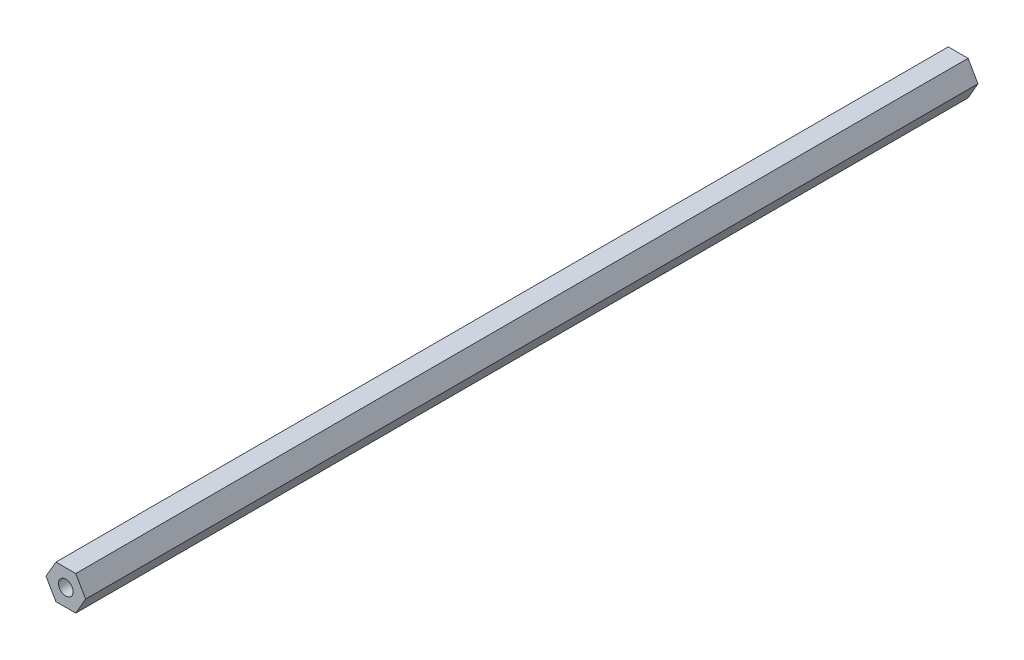
from build123d import *

# Parameters (mm, degrees)
BOSS_EXTRUDE1_DEPTH                   = 165.1
F_1_4_28_TAPPED_HOLE1_D               = 5.4102
F_1_4_28_TAPPED_HOLE1_DEPTH           = 28.194
F_1_4_28_TAPPED_HOLE1_TIP             = 1.625388061
F_1_4_28_TAPPED_HOLE1_ON_FACE_2_D     = 5.4102
F_1_4_28_TAPPED_HOLE1_ON_FACE_2_DEPTH = 28.194
F_1_4_28_TAPPED_HOLE1_ON_FACE_2_TIP   = 1.625388061


with BuildPart() as part:
    # Sketch1 → Boss-Extrude1 (new, symmetric)
    with BuildSketch(Plane.XY):
        Polygon((7.332348419, 0), (3.666174209, 6.35), (-3.666174209, 6.35), (-7.332348419, 0), (-3.666174209, -6.35), (3.666174209, -6.35), align=None)
    extrude(amount=BOSS_EXTRUDE1_DEPTH, both=True)

    # 1/4-28 Tapped Hole1
    with Locations(Plane.XY.offset(165.1)):
        with Locations((0, 0)):
            Hole(F_1_4_28_TAPPED_HOLE1_D / 2, depth=F_1_4_28_TAPPED_HOLE1_DEPTH)
            with Locations((0, 0, -(F_1_4_28_TAPPED_HOLE1_DEPTH + F_1_4_28_TAPPED_HOLE1_TIP / 2))):  # 118° drill point
                Cone(0, F_1_4_28_TAPPED_HOLE1_D / 2, F_1_4_28_TAPPED_HOLE1_TIP, mode=Mode.SUBTRACT)

    # 1/4-28 Tapped Hole1 on face 2
    with Locations(Plane(origin=(0, 0, -165.1), x_dir=(-1, 0, 0), z_dir=(0, 0, -1))):
        with Locations((0, 0)):
            Hole(F_1_4_28_TAPPED_HOLE1_ON_FACE_2_D / 2, depth=F_1_4_28_TAPPED_HOLE1_ON_FACE_2_DEPTH)
            with Locations((0, 0, -(F_1_4_28_TAPPED_HOLE1_ON_FACE_2_DEPTH + F_1_4_28_TAPPED_HOLE1_ON_FACE_2_TIP / 2))):  # 118° drill point
                Cone(0, F_1_4_28_TAPPED_HOLE1_ON_FACE_2_D / 2, F_1_4_28_TAPPED_HOLE1_ON_FACE_2_TIP, mode=Mode.SUBTRACT)


solid = part.part
